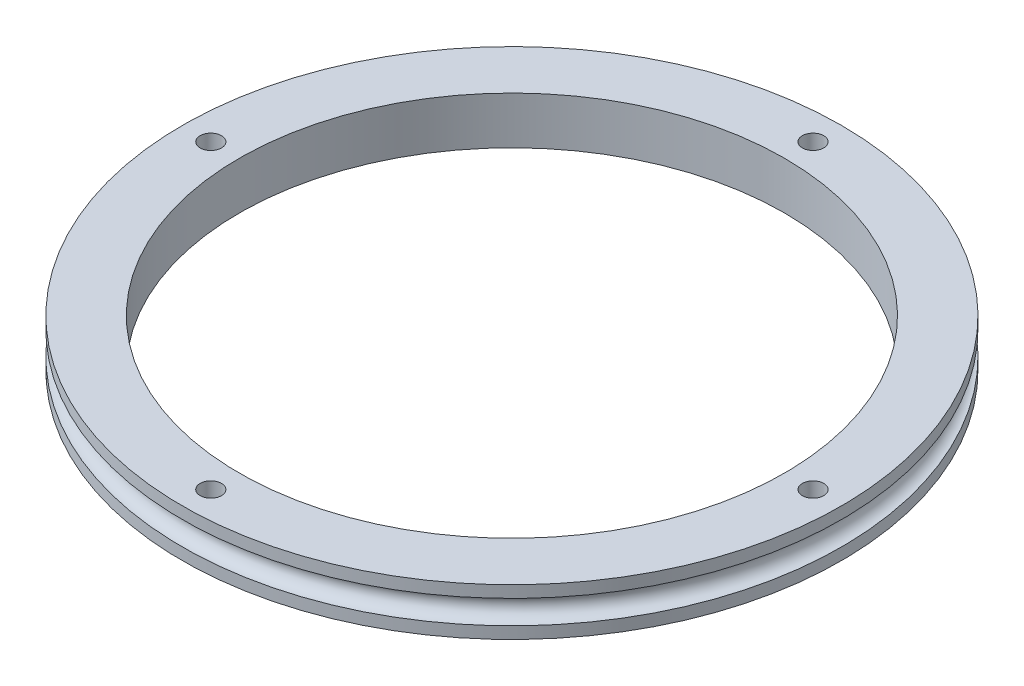
from build123d import *

# Parameters (mm, degrees)
CSK_FOR_M4_COUNTERSUNK_FLAT_HEAD_SCREW1_D           = 4.5
CSK_FOR_M4_COUNTERSUNK_FLAT_HEAD_SCREW1_CSINK_D     = 9.4
CSK_FOR_M4_COUNTERSUNK_FLAT_HEAD_SCREW1_CSINK_ANGLE = 90
CIRPATTERN1_COUNT                                   = 4


with BuildPart() as part:
    # Sketch1 → Revolve1 (revolve)
    with BuildSketch(Plane.XY, mode=Mode.PRIVATE) as revolve1_sk:
        with BuildLine():
            Line((-57.5, 5), (-57.5, -5))
            Line((-57.5, -5), (-69.5, -5))
            Line((-69.5, -5), (-69.5, -2.5))
            ThreePointArc((-69.5, -2.5), (-67, 0), (-69.5, 2.5))
            Line((-69.5, 2.5), (-69.5, 5))
            Line((-69.5, 5), (-57.5, 5))
        make_face()
    revolve(revolve1_sk.sketch.rotate(Axis((0, -5.61, 0), (0, 1, 0)), 270), axis=Axis((0, -5.61, 0), (0, 1, 0)))

    # CSK for M4 Countersunk Flat Head Screw1 (through all)
    with Locations(Plane(origin=(0, -5, 0), x_dir=(-1, 0, 0), z_dir=(0, -1, 0))):
        with Locations((63.5, 0)):
            csk_for_m4_countersunk_flat_head_screw1 = CounterSinkHole(CSK_FOR_M4_COUNTERSUNK_FLAT_HEAD_SCREW1_D / 2, CSK_FOR_M4_COUNTERSUNK_FLAT_HEAD_SCREW1_CSINK_D / 2, counter_sink_angle=CSK_FOR_M4_COUNTERSUNK_FLAT_HEAD_SCREW1_CSINK_ANGLE)

    # CirPattern1: CSK for M4 Countersunk Flat Head Screw1 ×4 about axis
    cirpattern1_axis = Axis((0, 0, 0), (0, 1, 0))
    for i in range(1, CIRPATTERN1_COUNT):
        add(csk_for_m4_countersunk_flat_head_screw1.rotate(cirpattern1_axis, i * 360 / CIRPATTERN1_COUNT), mode=Mode.SUBTRACT)


solid = part.part
